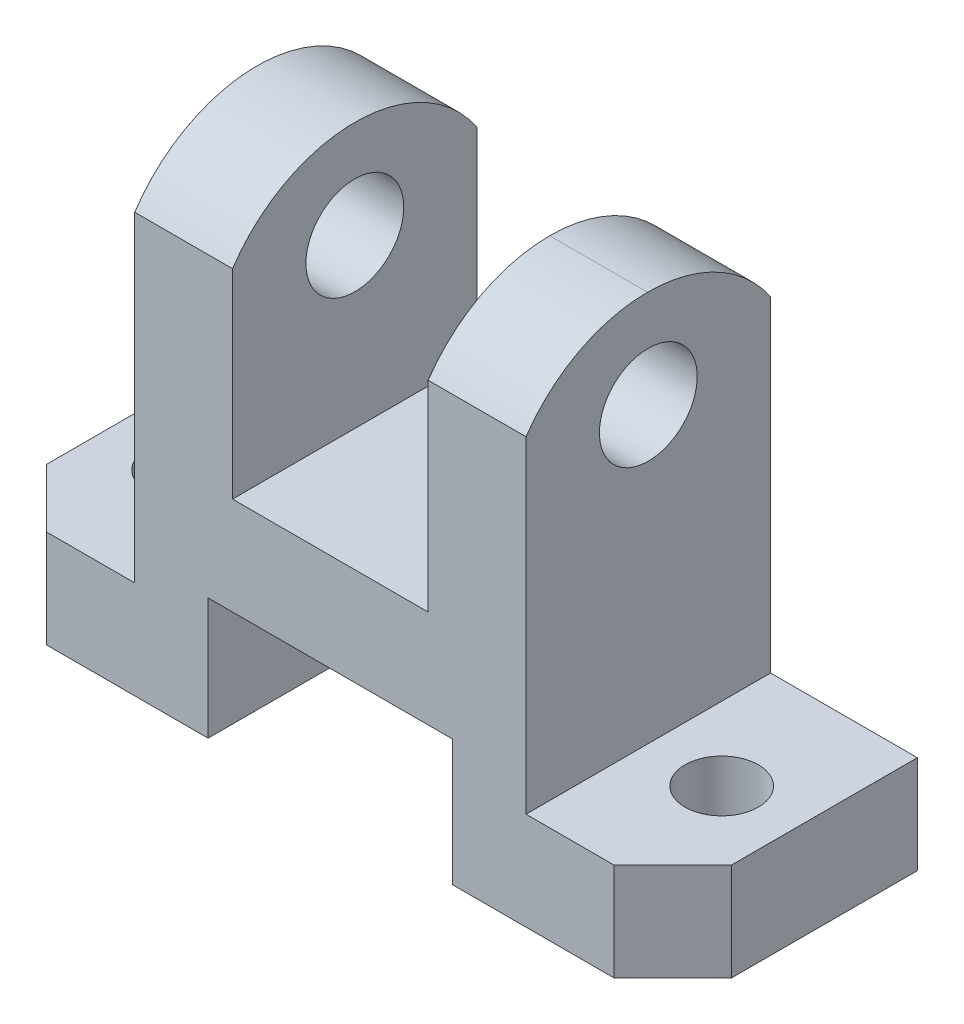
from build123d import *

# Parameters (mm, degrees)
BOSS_EXTRUDE1_DEPTH      = 31.75
CUT_EXTRUDE2_DEPTH       = 115.012526534
CUT_EXTRUDE2_DEPTH_BACK  = 115.012526534
SKETCH4_R                = 6.35
CUT_EXTRUDE3_DEPTH       = 88.332955112
CUT_EXTRUDE13_DEPTH      = 31.75
CUT_EXTRUDE18_DEPTH      = 25.4
CUT_EXTRUDE22_DEPTH      = 88.332955112
CUT_EXTRUDE22_DEPTH_BACK = 25.4
CUT_EXTRUDE23_DEPTH      = 25.4
SKETCH14_R               = 4.7625
CUT_EXTRUDE24_DEPTH      = 114.470708815
SKETCH15_R               = 4.7625
CUT_EXTRUDE25_DEPTH      = 114.470708815


with BuildPart() as part:
    # Sketch2 → Boss-Extrude1 (new body)
    with BuildSketch(Plane.XY):
        Polygon((-77.635875696, 41.712828345), (-64.935875696, 41.712828345), (-64.935875696, 6.683574613), (-39.535875696, 6.683574613), (-39.535875696, 41.10626118), (-26.835875696, 41.10626118), (-26.835875696, -9.69373882), (-7.785875696, -9.69373882), (-7.785875696, -22.39373882), (-36.360875696, -22.39373882), (-36.360875696, -6.016425387), (-68.110875696, -6.016425387), (-68.110875696, -21.787171655), (-96.685875696, -21.787171655), (-96.685875696, -9.087171655), (-77.635875696, -9.087171655), align=None)
    extrude(amount=BOSS_EXTRUDE1_DEPTH)

    # Sketch3 → Cut-Extrude2 (cut, two sides: drawn at the far end of the back side and taken through both)
    with BuildSketch(Plane(origin=(0, -9.69373882, 0), x_dir=(1, 0, 0), z_dir=(0, 1, 0)).offset(-CUT_EXTRUDE2_DEPTH_BACK)):
        Polygon((-96.685875696, -24.13), (-89.065875696, -31.75), (-96.685875696, -31.75), align=None)
        Polygon((-15.405875696, -31.75), (-7.785875696, -31.75), (-7.785875696, -24.13), align=None)
    extrude(amount=CUT_EXTRUDE2_DEPTH + CUT_EXTRUDE2_DEPTH_BACK, mode=Mode.SUBTRACT)

    # Sketch4 → Cut-Extrude3 (cut, through all)
    with BuildSketch(Plane(origin=(-26.835875696, 0, 0), x_dir=(0, 0, -1), z_dir=(1, 0, 0))):
        with Locations(Location((-15.875, 28.40626118, 0), (0, 0, 90))):
            Circle(SKETCH4_R)
    extrude(amount=-CUT_EXTRUDE3_DEPTH, mode=Mode.SUBTRACT)

    # Sketch9 → Cut-Extrude13 (cut)
    with BuildSketch(Plane(origin=(-26.835875696, 0, 0), x_dir=(0, 0, -1), z_dir=(1, 0, 0))):
        with BuildLine():
            Line((-31.75, 41.10626118), (-31.75, 32.743943383))
            ThreePointArc((-31.75, 32.743943383), (-24.905282657, 38.886336135), (-15.980537449, 41.10626118))
            Line((-15.980537449, 41.10626118), (-31.75, 41.10626118))
        make_face()
    extrude(amount=-CUT_EXTRUDE13_DEPTH, mode=Mode.SUBTRACT)

    # Sketch10 → Cut-Extrude18 (cut)
    with BuildSketch(Plane(origin=(-26.835875696, 0, 0), x_dir=(0, 0, -1), z_dir=(1, 0, 0))):
        with BuildLine():
            Line((0, 32.58654489), (0, 41.10626118))
            Line((0, 41.10626118), (-15.980537449, 41.10626118))
            ThreePointArc((-15.980537449, 41.10626118), (-6.9256611, 38.843300754), (0, 32.58654489))
        make_face()
    extrude(amount=-CUT_EXTRUDE18_DEPTH, mode=Mode.SUBTRACT)

    # Sketch11 → Cut-Extrude22 (cut, two sides: drawn at the far end of the back side and taken through both)
    with BuildSketch(Plane.ZY.offset(77.635875696).offset(-CUT_EXTRUDE22_DEPTH_BACK)):
        Polygon((-151.990316571, 41.10626118), (0, 41.10626118), (31.75, 41.10626118), (183.740316571, 41.10626118), (183.740316571, 345.086894323), (-151.990316571, 345.086894323), align=None)
    extrude(amount=CUT_EXTRUDE22_DEPTH + CUT_EXTRUDE22_DEPTH_BACK, mode=Mode.SUBTRACT)

    # Sketch13 → Cut-Extrude23 (cut)
    with BuildSketch(Plane.ZY.offset(77.635875696)):
        with BuildLine():
            Line((31.75, 41.10626118), (15.875, 41.10626118))
            ThreePointArc((15.875, 41.10626118), (24.883346001, 38.841737114), (31.75, 32.58654489))
            Line((31.75, 32.58654489), (31.75, 41.10626118))
        make_face()
        with BuildLine():
            Line((15.875, 41.10626118), (0, 41.10626118))
            Line((0, 41.10626118), (0, 32.58654489))
            ThreePointArc((0, 32.58654489), (6.866653999, 38.841737114), (15.875, 41.10626118))
        make_face()
    extrude(amount=-CUT_EXTRUDE23_DEPTH, mode=Mode.SUBTRACT)

    # Sketch14 → Cut-Extrude24 (cut, through all)
    with BuildSketch(Plane(origin=(0, -9.087171655, 0), x_dir=(1, 0, 0), z_dir=(0, 1, 0))):
        with Locations(Location((-17.310875696, -15.875, 0), (0, 0, 180))):
            Circle(SKETCH14_R)
    extrude(amount=-CUT_EXTRUDE24_DEPTH, mode=Mode.SUBTRACT)

    # Sketch15 → Cut-Extrude25 (cut, through all)
    with BuildSketch(Plane(origin=(0, -9.087171655, 0), x_dir=(1, 0, 0), z_dir=(0, 1, 0))):
        with Locations(Location((-87.160875696, -15.875, 0), (0, 0, 180))):
            Circle(SKETCH15_R)
    extrude(amount=-CUT_EXTRUDE25_DEPTH, mode=Mode.SUBTRACT)


solid = part.part
